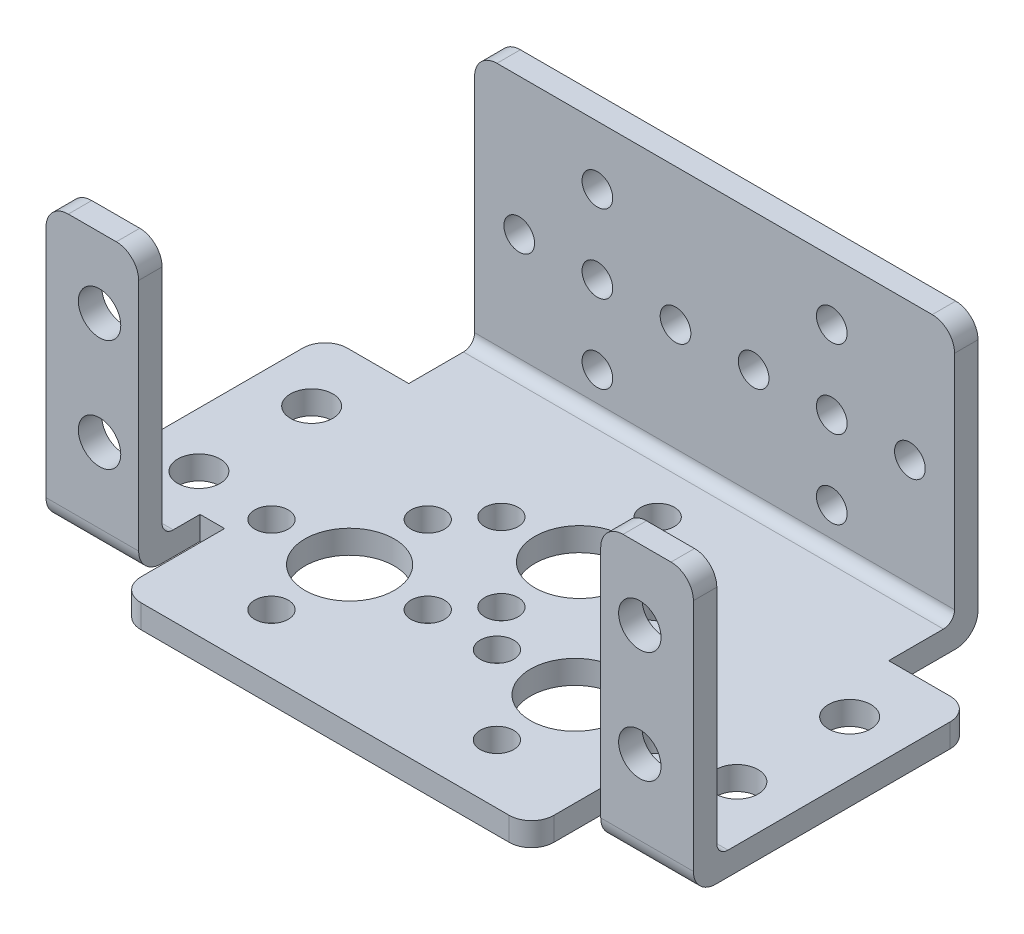
from build123d import *

# Parameters (mm, degrees)
SKETCH1_W           = 58
SKETCH1_H           = 25
BOSS_EXTRUDE1_DEPTH = 37
SKETCH2_W           = 28.8
SKETCH2_H           = 22.9
CUT_EXTRUDE1_DEPTH  = 70.923172125
CUT_EXTRUDE2_REACH  = 50.644
SKETCH3_W           = 40.6
SKETCH3_H           = 22.9
SKETCH4_W           = 7.5
SKETCH4_H           = 8
CUT_EXTRUDE3_DEPTH  = 54.244718048
CUT_EXTRUDE4_DEPTH  = 54.244718048
SKETCH8_R           = 4
SKETCH8_R_2         = 1.5
SKETCH8_R_3         = 1.9
CUT_EXTRUDE5_DEPTH  = 53.291586321
CUT_EXTRUDE6_REACH  = 47.675
SKETCH9_R           = 1.9
CUT_EXTRUDE7_REACH  = 50.644
SKETCH10_R          = 1.375
FILLET1_R           = 2
FILLET2_R           = 1


with BuildPart() as part:
    # Sketch1 → Boss-Extrude1 (new body)
    with BuildSketch(Plane.XY):
        Rectangle(SKETCH1_W, SKETCH1_H)
    extrude(amount=BOSS_EXTRUDE1_DEPTH)

    # Sketch2 → Cut-Extrude1 (cut, through all)
    with BuildSketch(Plane.ZY.offset(29)):
        with Locations((16.5, 1.05)):
            Rectangle(SKETCH2_W, SKETCH2_H)
    extrude(amount=-CUT_EXTRUDE1_DEPTH, mode=Mode.SUBTRACT)

    # Sketch3 → Cut-Extrude2 (cut, up to next)
    with BuildSketch(Plane.XY.offset(37), mode=Mode.PRIVATE) as cut_extrude2_sk1:
        with Locations((0, 1.05)):
            Rectangle(SKETCH3_W, SKETCH3_H)
    cut_extrude2_tool1 = extrude(cut_extrude2_sk1.sketch, amount=-CUT_EXTRUDE2_REACH, mode=Mode.PRIVATE) & part.part
    add(cut_extrude2_tool1.solids().sort_by_distance((0, 1.05, 37))[0], mode=Mode.SUBTRACT)

    # Sketch4 → Cut-Extrude3 (cut, through all)
    with BuildSketch(Plane.XZ.offset(12.5)):
        with Locations((-25.25, 4)):
            Rectangle(SKETCH4_W, SKETCH4_H)
        with Locations((25.25, 4)):
            Rectangle(SKETCH4_W, SKETCH4_H)
    extrude(amount=-CUT_EXTRUDE3_DEPTH, mode=Mode.SUBTRACT)

    # Sketch7 → Cut-Extrude4 (cut, through all)
    with BuildSketch(Plane.XZ.offset(12.5)):
        Polygon((-29, 37), (-18.5, 37), (-18.5, 33), (-18.5, 27.5), (-20.7, 27.5), (-20.7, 33), (-29, 33), align=None)
        Polygon((29, 37), (18.5, 37), (18.5, 33), (18.5, 27.5), (20.7, 27.5), (20.7, 33), (29, 33), align=None)
    extrude(amount=-CUT_EXTRUDE4_DEPTH, mode=Mode.SUBTRACT)

    # Sketch8 → Cut-Extrude5 (cut, through all)
    with BuildSketch(Plane(origin=(0, -10.4, 0), x_dir=(-1, 0, 0), z_dir=(0, 1, 0))):
        with Locations(Location((0, 14.2, 0), (0, 0, 90))):
            Circle(SKETCH8_R)
        with Locations(Location((7, 14.2, 0), (0, 0, 90))):
            Circle(SKETCH8_R_2)
        with Locations(Location((-7, 14.2, 0), (0, 0, 90))):
            Circle(SKETCH8_R_2)
        with Locations(Location((0, 7.2, 0), (0, 0, 90))):
            Circle(SKETCH8_R_2)
        with Locations(Location((0, 21.2, 0), (0, 0, 90))):
            Circle(SKETCH8_R_2)
        with Locations(Location((10.1, 24.7, 0), (0, 0, 90))):
            Circle(SKETCH8_R)
        with Locations(Location((17.1, 24.7, 0), (0, 0, 90))):
            Circle(SKETCH8_R_2)
        with Locations(Location((3.1, 24.7, 0), (0, 0, 90))):
            Circle(SKETCH8_R_2)
        with Locations(Location((10.1, 17.7, 0), (0, 0, 90))):
            Circle(SKETCH8_R_2)
        with Locations(Location((10.1, 31.7, 0), (0, 0, 90))):
            Circle(SKETCH8_R_2)
        with Locations(Location((-10.1, 24.7, 0), (0, 0, 90))):
            Circle(SKETCH8_R)
        with Locations(Location((-3.1, 24.7, 0), (0, 0, 90))):
            Circle(SKETCH8_R_2)
        with Locations(Location((-17.1, 24.7, 0), (0, 0, 90))):
            Circle(SKETCH8_R_2)
        with Locations(Location((-10.1, 17.7, 0), (0, 0, 90))):
            Circle(SKETCH8_R_2)
        with Locations(Location((-10.1, 31.7, 0), (0, 0, 90))):
            Circle(SKETCH8_R_2)
        with Locations(Location((24.1, 24.2, 0), (0, 0, 90))):
            Circle(SKETCH8_R_3)
        with Locations(Location((24.1, 14.1, 0), (0, 0, 90))):
            Circle(SKETCH8_R_3)
        with Locations(Location((-24.1, 14.1, 0), (0, 0, 90))):
            Circle(SKETCH8_R_3)
        with Locations(Location((-24.1, 24.2, 0), (0, 0, 90))):
            Circle(SKETCH8_R_3)
    extrude(amount=-CUT_EXTRUDE5_DEPTH, mode=Mode.SUBTRACT)

    # Sketch9 → Cut-Extrude6 (cut, up to next)
    with BuildSketch(Plane.XY.offset(33), mode=Mode.PRIVATE) as cut_extrude6_sk1:
        with Locations((-24.2, 6.2)):
            Circle(SKETCH9_R)
    cut_extrude6_tool1 = extrude(cut_extrude6_sk1.sketch, amount=-CUT_EXTRUDE6_REACH, mode=Mode.PRIVATE) & part.part
    # Sketch9 → Cut-Extrude6 (cut, up to next)
    with BuildSketch(Plane.XY.offset(33), mode=Mode.PRIVATE) as cut_extrude6_sk2:
        with Locations((-24.2, -3.8)):
            Circle(SKETCH9_R)
    cut_extrude6_tool2 = extrude(cut_extrude6_sk2.sketch, amount=-CUT_EXTRUDE6_REACH, mode=Mode.PRIVATE) & part.part
    # Sketch9 → Cut-Extrude6 (cut, up to next)
    with BuildSketch(Plane.XY.offset(33), mode=Mode.PRIVATE) as cut_extrude6_sk3:
        with Locations((24.2, 6.2)):
            Circle(SKETCH9_R)
    cut_extrude6_tool3 = extrude(cut_extrude6_sk3.sketch, amount=-CUT_EXTRUDE6_REACH, mode=Mode.PRIVATE) & part.part
    # Sketch9 → Cut-Extrude6 (cut, up to next)
    with BuildSketch(Plane.XY.offset(33), mode=Mode.PRIVATE) as cut_extrude6_sk4:
        with Locations((24.2, -3.8)):
            Circle(SKETCH9_R)
    cut_extrude6_tool4 = extrude(cut_extrude6_sk4.sketch, amount=-CUT_EXTRUDE6_REACH, mode=Mode.PRIVATE) & part.part
    add(cut_extrude6_tool1.solids().sort_by_distance((-24.2, 6.2, 33))[0], mode=Mode.SUBTRACT)
    add(cut_extrude6_tool2.solids().sort_by_distance((-24.2, -3.8, 33))[0], mode=Mode.SUBTRACT)
    add(cut_extrude6_tool3.solids().sort_by_distance((24.2, 6.2, 33))[0], mode=Mode.SUBTRACT)
    add(cut_extrude6_tool4.solids().sort_by_distance((24.2, -3.8, 33))[0], mode=Mode.SUBTRACT)

    # Sketch10 → Cut-Extrude7 (cut, up to next)
    with BuildSketch(Plane(origin=(0, 0, 0), x_dir=(-1, 0, 0), z_dir=(0, 0, -1)), mode=Mode.PRIVATE) as cut_extrude7_sk1:
        with Locations((-17.5, 0.22)):
            Circle(SKETCH10_R)
    cut_extrude7_tool1 = extrude(cut_extrude7_sk1.sketch, amount=-CUT_EXTRUDE7_REACH, mode=Mode.PRIVATE) & part.part
    # Sketch10 → Cut-Extrude7 (cut, up to next)
    with BuildSketch(Plane(origin=(0, 0, 0), x_dir=(-1, 0, 0), z_dir=(0, 0, -1)), mode=Mode.PRIVATE) as cut_extrude7_sk2:
        with Locations((-10.5, 0.22)):
            Circle(SKETCH10_R)
    cut_extrude7_tool2 = extrude(cut_extrude7_sk2.sketch, amount=-CUT_EXTRUDE7_REACH, mode=Mode.PRIVATE) & part.part
    # Sketch10 → Cut-Extrude7 (cut, up to next)
    with BuildSketch(Plane(origin=(0, 0, 0), x_dir=(-1, 0, 0), z_dir=(0, 0, -1)), mode=Mode.PRIVATE) as cut_extrude7_sk3:
        with Locations((-3.5, 0.22)):
            Circle(SKETCH10_R)
    cut_extrude7_tool3 = extrude(cut_extrude7_sk3.sketch, amount=-CUT_EXTRUDE7_REACH, mode=Mode.PRIVATE) & part.part
    # Sketch10 → Cut-Extrude7 (cut, up to next)
    with BuildSketch(Plane(origin=(0, 0, 0), x_dir=(-1, 0, 0), z_dir=(0, 0, -1)), mode=Mode.PRIVATE) as cut_extrude7_sk4:
        with Locations((3.5, 0.22)):
            Circle(SKETCH10_R)
    cut_extrude7_tool4 = extrude(cut_extrude7_sk4.sketch, amount=-CUT_EXTRUDE7_REACH, mode=Mode.PRIVATE) & part.part
    # Sketch10 → Cut-Extrude7 (cut, up to next)
    with BuildSketch(Plane(origin=(0, 0, 0), x_dir=(-1, 0, 0), z_dir=(0, 0, -1)), mode=Mode.PRIVATE) as cut_extrude7_sk5:
        with Locations((10.5, 0.22)):
            Circle(SKETCH10_R)
    cut_extrude7_tool5 = extrude(cut_extrude7_sk5.sketch, amount=-CUT_EXTRUDE7_REACH, mode=Mode.PRIVATE) & part.part
    # Sketch10 → Cut-Extrude7 (cut, up to next)
    with BuildSketch(Plane(origin=(0, 0, 0), x_dir=(-1, 0, 0), z_dir=(0, 0, -1)), mode=Mode.PRIVATE) as cut_extrude7_sk6:
        with Locations((17.5, 0.22)):
            Circle(SKETCH10_R)
    cut_extrude7_tool6 = extrude(cut_extrude7_sk6.sketch, amount=-CUT_EXTRUDE7_REACH, mode=Mode.PRIVATE) & part.part
    # Sketch10 → Cut-Extrude7 (cut, up to next)
    with BuildSketch(Plane(origin=(0, 0, 0), x_dir=(-1, 0, 0), z_dir=(0, 0, -1)), mode=Mode.PRIVATE) as cut_extrude7_sk7:
        with Locations((-10.5, 7.22)):
            Circle(SKETCH10_R)
    cut_extrude7_tool7 = extrude(cut_extrude7_sk7.sketch, amount=-CUT_EXTRUDE7_REACH, mode=Mode.PRIVATE) & part.part
    # Sketch10 → Cut-Extrude7 (cut, up to next)
    with BuildSketch(Plane(origin=(0, 0, 0), x_dir=(-1, 0, 0), z_dir=(0, 0, -1)), mode=Mode.PRIVATE) as cut_extrude7_sk8:
        with Locations((10.5, 7.22)):
            Circle(SKETCH10_R)
    cut_extrude7_tool8 = extrude(cut_extrude7_sk8.sketch, amount=-CUT_EXTRUDE7_REACH, mode=Mode.PRIVATE) & part.part
    # Sketch10 → Cut-Extrude7 (cut, up to next)
    with BuildSketch(Plane(origin=(0, 0, 0), x_dir=(-1, 0, 0), z_dir=(0, 0, -1)), mode=Mode.PRIVATE) as cut_extrude7_sk9:
        with Locations((-10.5, -6.78)):
            Circle(SKETCH10_R)
    cut_extrude7_tool9 = extrude(cut_extrude7_sk9.sketch, amount=-CUT_EXTRUDE7_REACH, mode=Mode.PRIVATE) & part.part
    # Sketch10 → Cut-Extrude7 (cut, up to next)
    with BuildSketch(Plane(origin=(0, 0, 0), x_dir=(-1, 0, 0), z_dir=(0, 0, -1)), mode=Mode.PRIVATE) as cut_extrude7_sk10:
        with Locations((10.5, -6.78)):
            Circle(SKETCH10_R)
    cut_extrude7_tool10 = extrude(cut_extrude7_sk10.sketch, amount=-CUT_EXTRUDE7_REACH, mode=Mode.PRIVATE) & part.part
    add(cut_extrude7_tool1.solids().sort_by_distance((17.5, 0.22, 0))[0], mode=Mode.SUBTRACT)
    add(cut_extrude7_tool2.solids().sort_by_distance((10.5, 0.22, 0))[0], mode=Mode.SUBTRACT)
    add(cut_extrude7_tool3.solids().sort_by_distance((3.5, 0.22, 0))[0], mode=Mode.SUBTRACT)
    add(cut_extrude7_tool4.solids().sort_by_distance((-3.5, 0.22, 0))[0], mode=Mode.SUBTRACT)
    add(cut_extrude7_tool5.solids().sort_by_distance((-10.5, 0.22, 0))[0], mode=Mode.SUBTRACT)
    add(cut_extrude7_tool6.solids().sort_by_distance((-17.5, 0.22, 0))[0], mode=Mode.SUBTRACT)
    add(cut_extrude7_tool7.solids().sort_by_distance((10.5, 7.22, 0))[0], mode=Mode.SUBTRACT)
    add(cut_extrude7_tool8.solids().sort_by_distance((-10.5, 7.22, 0))[0], mode=Mode.SUBTRACT)
    add(cut_extrude7_tool9.solids().sort_by_distance((10.5, -6.78, 0))[0], mode=Mode.SUBTRACT)
    add(cut_extrude7_tool10.solids().sort_by_distance((-10.5, -6.78, 0))[0], mode=Mode.SUBTRACT)

    # Fillet1
    fillet1_edges = [part.edges().sort_by_distance(p)[0] for p in [
        (-29, 12.5, 31.95),
        (29, 12.5, 31.95),
        (-18.5, -11.45, 37),
        (-20.7, 12.5, 31.95),
        (-24.85, -12.5, 33),
        (20.7, 12.5, 31.95),
        (18.5, -11.45, 37),
        (24.85, -12.5, 33),
        (0, -12.5, 0),
        (-29, -11.45, 8),
        (-21.5, 12.5, 1.05),
        (29, -11.45, 8),
        (21.5, 12.5, 1.05),
    ]]
    fillet(fillet1_edges, radius=FILLET1_R)

    # Fillet2
    fillet2_edges = [part.edges().sort_by_distance(p)[0] for p in [
        (-24.85, -10.4, 30.9),
        (24.85, -10.4, 30.9),
        (0, -10.4, 2.1),
    ]]
    fillet(fillet2_edges, radius=FILLET2_R)


solid = part.part
